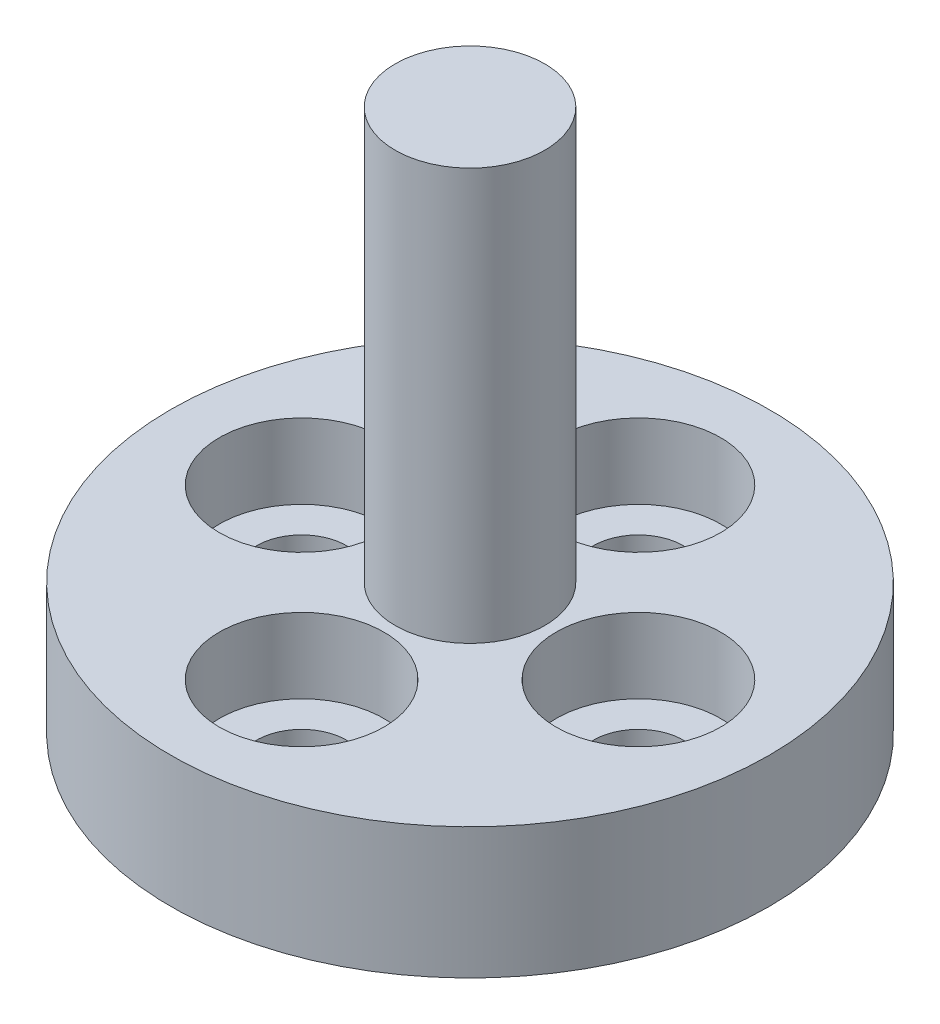
from build123d import *

# Parameters (mm, degrees)
CBORE_FOR_M2_SHCS1_D           = 2.4
CBORE_FOR_M2_SHCS1_CBORE_D     = 4.4
CBORE_FOR_M2_SHCS1_CBORE_DEPTH = 2


with BuildPart() as part:
    # Sketch1 → Revolve18 (revolve)
    with BuildSketch(Plane.XY, mode=Mode.PRIVATE) as revolve18_sk:
        Polygon((0, 14.5), (0, 0), (8, 0), (8, 3.5), (2, 3.5), (2, 14.5), align=None)
    revolve(revolve18_sk.sketch.rotate(Axis((0, 14.5, 0), (0, -1, 0)), 180), axis=Axis((0, 14.5, 0), (0, -1, 0)))

    # CBORE for M2 SHCS1 (through all)
    with Locations(Plane(origin=(0, 3.5, 0), x_dir=(1, 0, 0), z_dir=(0, 1, 0))):
        with Locations((-4.5, 0), (0, 4.5), (4.5, 0), (0, -4.5)):
            CounterBoreHole(CBORE_FOR_M2_SHCS1_D / 2, CBORE_FOR_M2_SHCS1_CBORE_D / 2, CBORE_FOR_M2_SHCS1_CBORE_DEPTH)


solid = part.part
